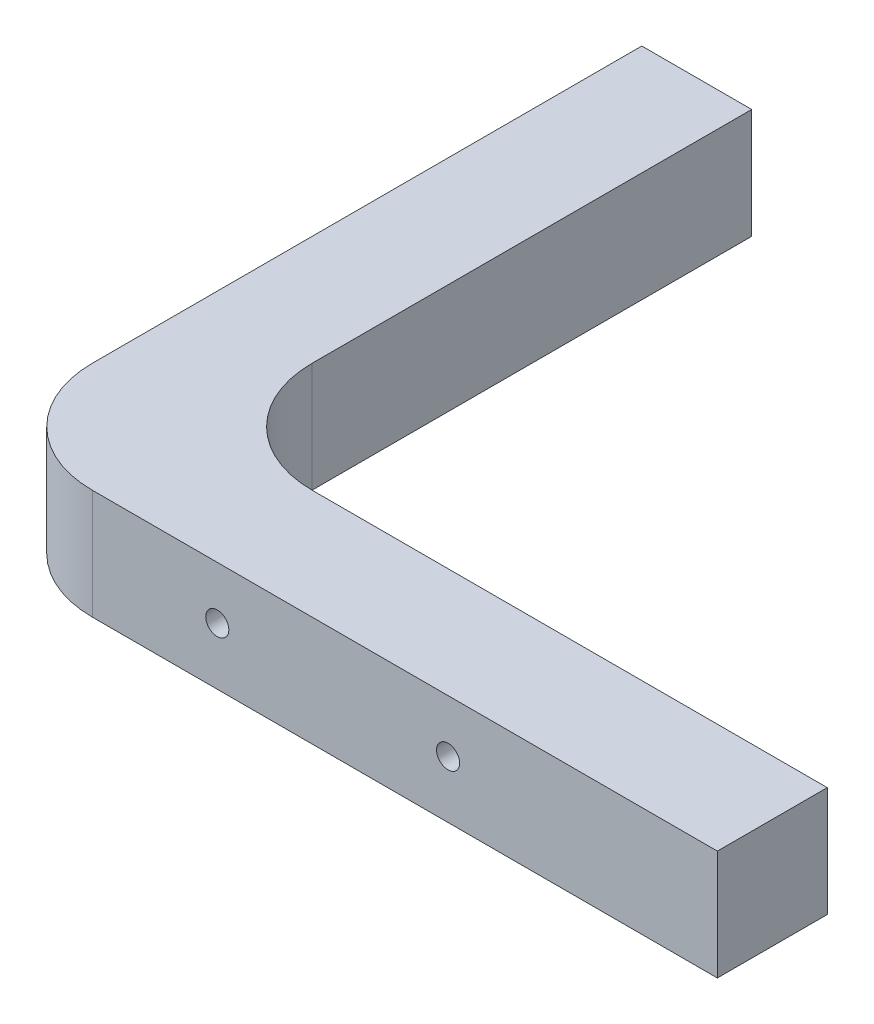
from build123d import *

# Parameters (mm, degrees)
BOSS_EXTRUDE1_DEPTH = 20
SKETCH2_R           = 2.1
CUT_EXTRUDE3_DEPTH  = 20


with BuildPart() as part:
    # Sketch1 → Boss-Extrude1 (new body)
    with BuildSketch(Plane(origin=(0, 0, 0), x_dir=(1, 0, 0), z_dir=(0, 1, 0))):
        with BuildLine():
            Line((23.176256614, 46.721781305), (-90.573743386, 46.721781305))
            ThreePointArc((-90.573743386, 46.721781305), (-104.71587901, 52.579645681), (-110.573743386, 66.721781305))
            Line((-110.573743386, 66.721781305), (-110.573743386, 166.721781305))
            Line((-110.573743386, 166.721781305), (-90.573743386, 166.721781305))
            Line((-90.573743386, 166.721781305), (-90.573743386, 86.721781305))
            ThreePointArc((-90.573743386, 86.721781305), (-84.71587901, 72.579645681), (-70.573743386, 66.721781305))
            Line((-70.573743386, 66.721781305), (23.176256614, 66.721781305))
            Line((23.176256614, 66.721781305), (23.176256614, 46.721781305))
        make_face()
    extrude(amount=BOSS_EXTRUDE1_DEPTH)

    # Sketch2 → Cut-Extrude3 (cut)
    with BuildSketch(Plane(origin=(0, 0, -66.721781305), x_dir=(-1, 0, 0), z_dir=(0, 0, -1))):
        with Locations((25.823743386, 10.397679773)):
            Circle(SKETCH2_R)
        with Locations((67.823743386, 10.397679773)):
            Circle(SKETCH2_R)
    extrude(amount=-CUT_EXTRUDE3_DEPTH, mode=Mode.SUBTRACT)


solid = part.part
